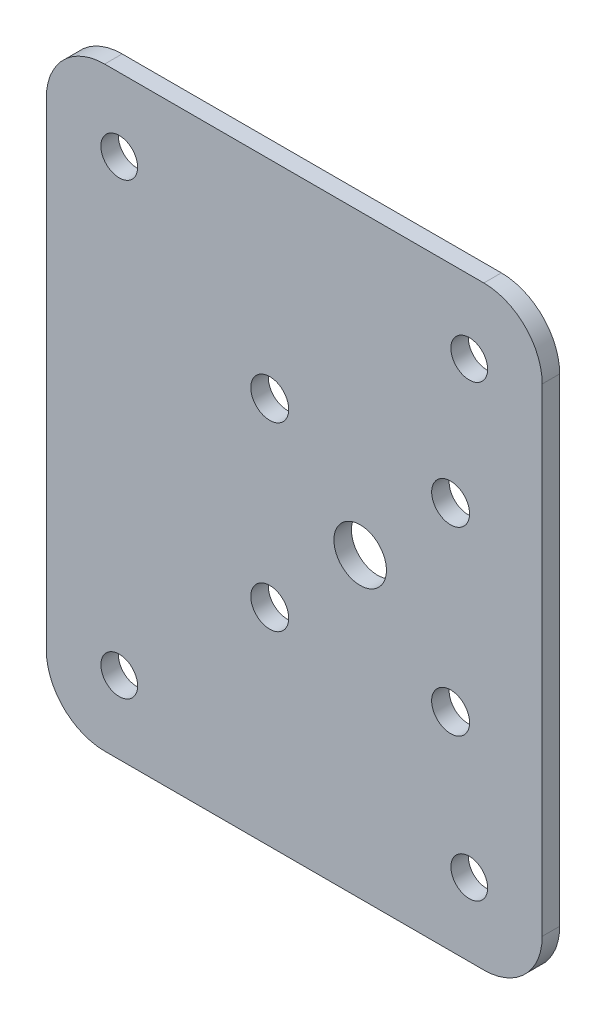
from build123d import *

# Parameters (mm, degrees)
CROQUIS1_W              = 85
CROQUIS1_H              = 102
CROQUIS1_R              = 4.5
CROQUIS1_R_2            = 3.25
CROQUIS1_R_3            = 3.15
SALIENTE_EXTRUIR1_DEPTH = 3
REDONDEO1_R             = 10


with BuildPart() as part:
    # Croquis1 → Saliente-Extruir1 (new body)
    with BuildSketch(Plane.XY):
        with Locations((-11.3, 0)):
            Rectangle(CROQUIS1_W, CROQUIS1_H)
        Circle(CROQUIS1_R, mode=Mode.SUBTRACT)
        with Locations((15.5, 15.5)):
            Circle(CROQUIS1_R_2, mode=Mode.SUBTRACT)
        with Locations(Location((-15.5, 15.5, 0), (0, 0, 180))):
            Circle(CROQUIS1_R_2, mode=Mode.SUBTRACT)
        with Locations(Location((15.5, -15.5, 0), (0, 0, 180))):
            Circle(CROQUIS1_R_2, mode=Mode.SUBTRACT)
        with Locations((-15.5, -15.5)):
            Circle(CROQUIS1_R_2, mode=Mode.SUBTRACT)
        with Locations((-41.3, 38.5)):
            Circle(CROQUIS1_R_3, mode=Mode.SUBTRACT)
        with Locations((18.7, 38.5)):
            Circle(CROQUIS1_R_3, mode=Mode.SUBTRACT)
        with Locations(Location((18.7, -38.5, 0), (0, 0, 180))):
            Circle(CROQUIS1_R_3, mode=Mode.SUBTRACT)
        with Locations(Location((-41.3, -38.5, 0), (0, 0, 180))):
            Circle(CROQUIS1_R_3, mode=Mode.SUBTRACT)
    extrude(amount=SALIENTE_EXTRUIR1_DEPTH)

    # Redondeo1
    redondeo1_edges = [part.edges().sort_by_distance(p)[0] for p in [
        (-53.8, 51, 1.5),
        (31.2, 51, 1.5),
        (31.2, -51, 1.5),
        (-53.8, -51, 1.5),
    ]]
    fillet(redondeo1_edges, radius=REDONDEO1_R)


solid = part.part
